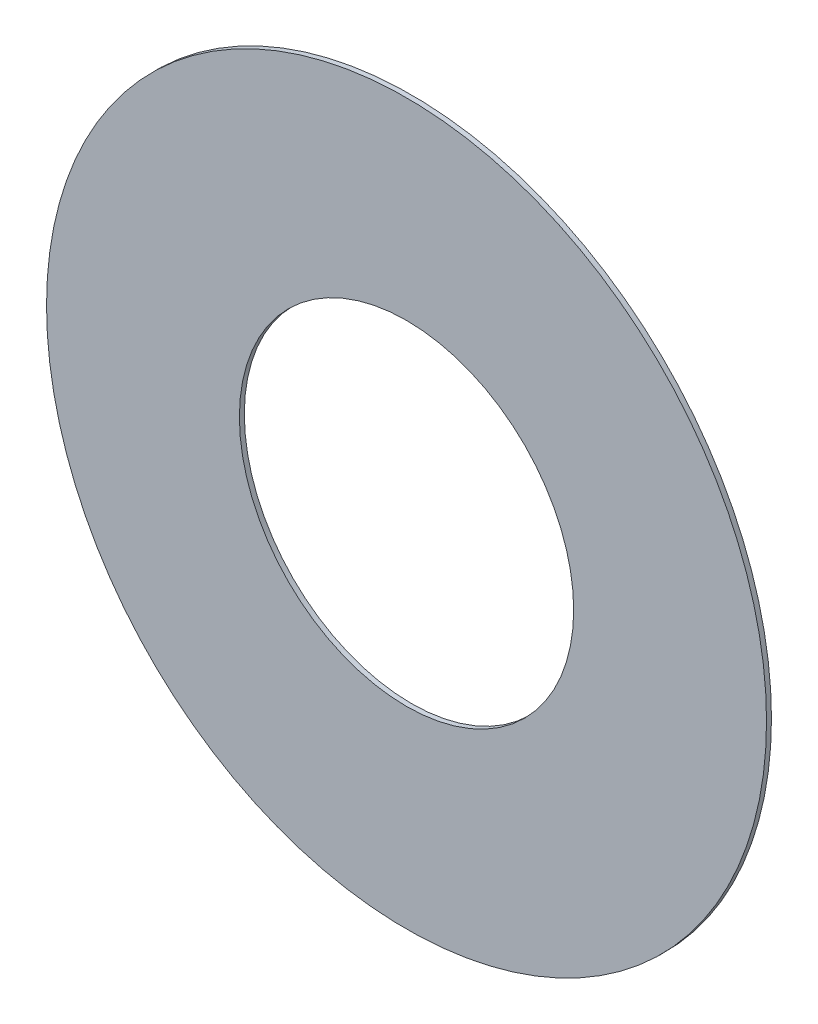
from build123d import *

# Parameters (mm, degrees)
SKETCH1_R           = 5.55625
SKETCH1_R_2         = 2.5796875
BOSS_EXTRUDE1_DEPTH = 0.0762


with BuildPart() as part:
    # Sketch1 → Boss-Extrude1 (new body)
    with BuildSketch(Plane(origin=(0, 0, 0), x_dir=(-1, 0, 0), z_dir=(0, 0, -1))):
        Circle(SKETCH1_R)
        Circle(SKETCH1_R_2, mode=Mode.SUBTRACT)
    extrude(amount=-BOSS_EXTRUDE1_DEPTH)


solid = part.part
